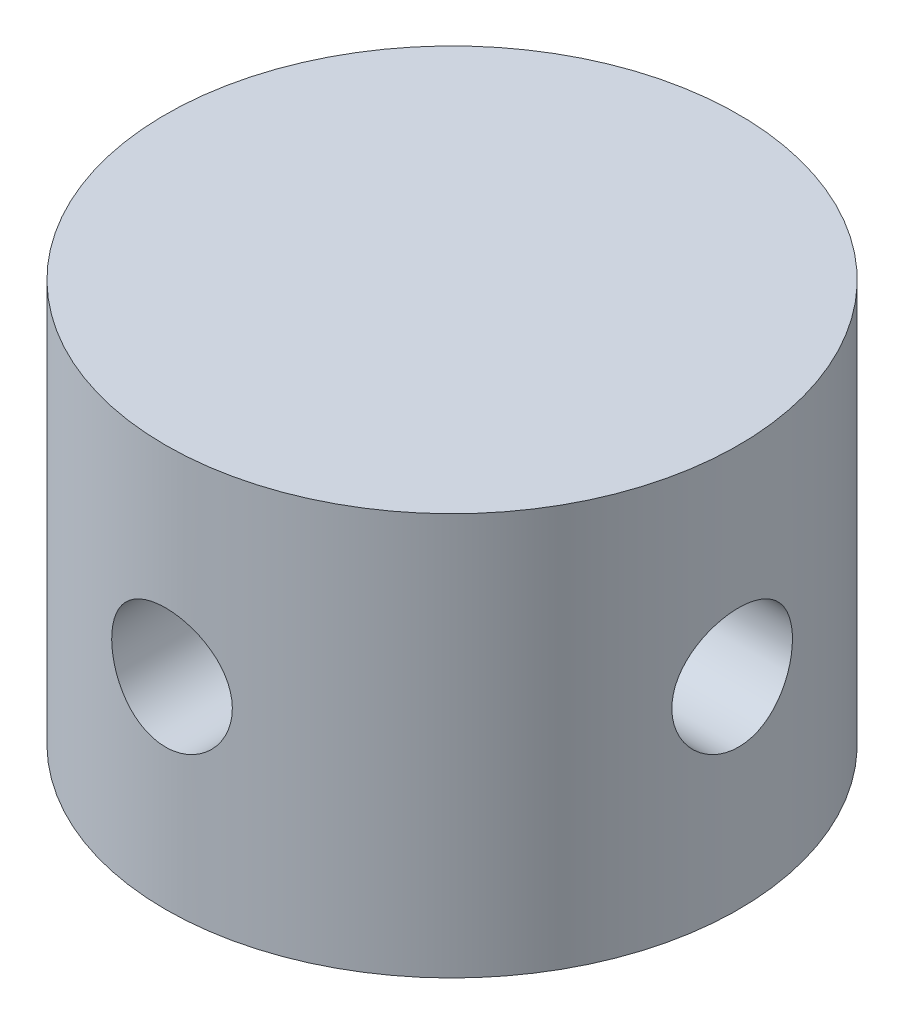
from build123d import *

# Parameters (mm, degrees)
SKETCH1_R           = 14.25
BOSS_EXTRUDE1_DEPTH = 20
SKETCH2_R           = 3
CUT_EXTRUDE1_DEPTH  = 9
CIRPATTERN1_COUNT   = 4


with BuildPart() as part:
    # Sketch1 → Boss-Extrude1 (new body)
    with BuildSketch(Plane(origin=(0, 0, 0), x_dir=(1, 0, 0), z_dir=(0, 1, 0))):
        Circle(SKETCH1_R)
    extrude(amount=BOSS_EXTRUDE1_DEPTH)

    # Sketch2 → Cut-Extrude1 (cut)
    with BuildSketch(Plane(origin=(14.25, 0, 0), x_dir=(0, 0, -1), z_dir=(1, 0, 0))):
        with Locations((0, 9.995362646)):
            Circle(SKETCH2_R)
    cut_extrude1 = extrude(amount=-CUT_EXTRUDE1_DEPTH, mode=Mode.SUBTRACT)

    # CirPattern1: Cut-Extrude1 ×4 about axis
    cirpattern1_axis = Axis((0, 20, 0), (0, -1, 0))
    for i in range(1, CIRPATTERN1_COUNT):
        add(cut_extrude1.rotate(cirpattern1_axis, i * 360 / CIRPATTERN1_COUNT), mode=Mode.SUBTRACT)


solid = part.part
